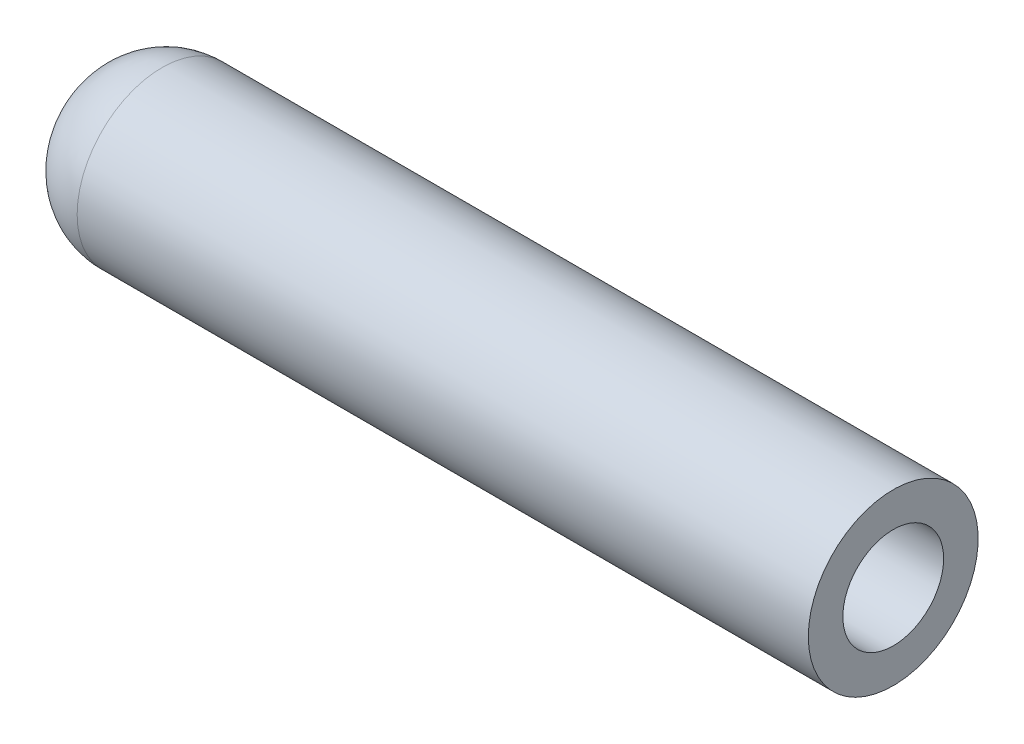
from build123d import *

# Parameters (mm, degrees)
SKETCH3_R          = 5
CUT_EXTRUDE1_DEPTH = 50


with BuildPart() as part:
    # Sketch2 → Revolve3 (revolve)
    with BuildSketch(Plane.XY, mode=Mode.PRIVATE) as revolve3_sk:
        with BuildLine():
            Line((0, 7.5), (72.557647174, 7.5))
            Line((72.557647174, 7.5), (72.557647174, -0.928107977))
            Line((72.557647174, -0.928107977), (-7.442352826, -0.928107977))
            ThreePointArc((-7.442352826, -0.928107977), (-5.621868454, 4.96433229), (0, 7.5))
        make_face()
    revolve(revolve3_sk.sketch.rotate(Axis((-7.442352826, -0.928107977, 0), (1, 0, 0)), 90), axis=Axis((-7.442352826, -0.928107977, 0), (1, 0, 0)))

    # Sketch3 → Cut-Extrude1 (cut)
    with BuildSketch(Plane(origin=(72.557647174, 0, 0), x_dir=(0, 0, -1), z_dir=(1, 0, 0))):
        with Locations((0, -0.928107977)):
            Circle(SKETCH3_R)
    extrude(amount=-CUT_EXTRUDE1_DEPTH, mode=Mode.SUBTRACT)


solid = part.part
